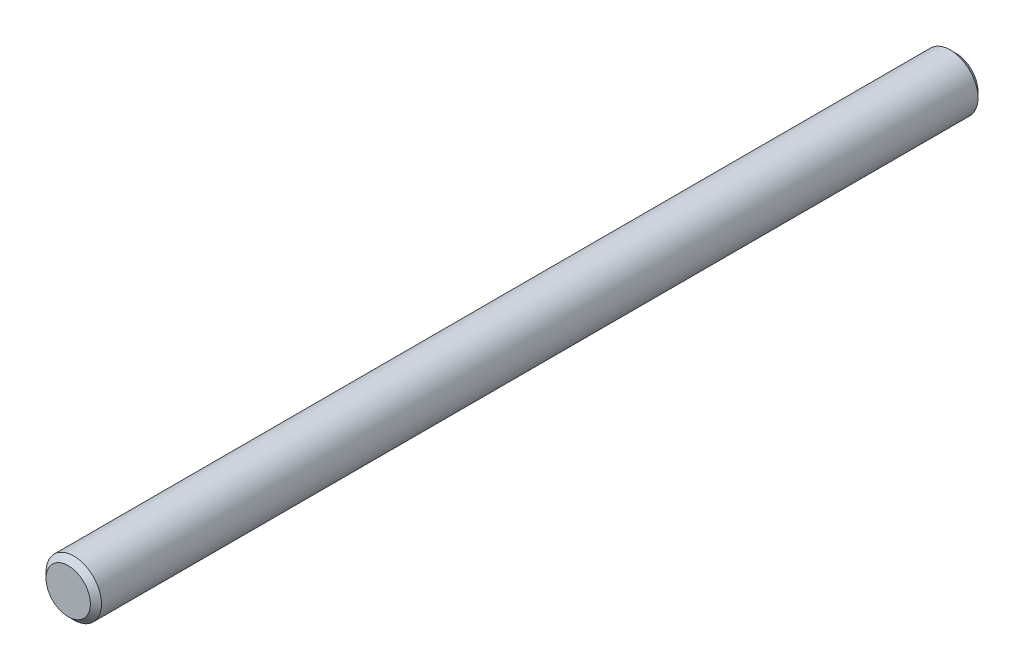
from build123d import *

# Parameters (mm, degrees)
SKETCH3_R           = 3.175
BOSS_EXTRUDE1_DEPTH = 50.8
CHAMFER1_SIZE       = 0.635


with BuildPart() as part:
    # Sketch3 → Boss-Extrude1 (new, symmetric)
    with BuildSketch(Plane.XY):
        Circle(SKETCH3_R)
    extrude(amount=BOSS_EXTRUDE1_DEPTH, both=True)

    # Chamfer1
    chamfer1_edges = [part.edges().sort_by_distance(p)[0] for p in [
        (-3.175, 0, -50.8),
        (-3.175, 0, 50.8),
    ]]
    chamfer(chamfer1_edges, length=CHAMFER1_SIZE)


solid = part.part
